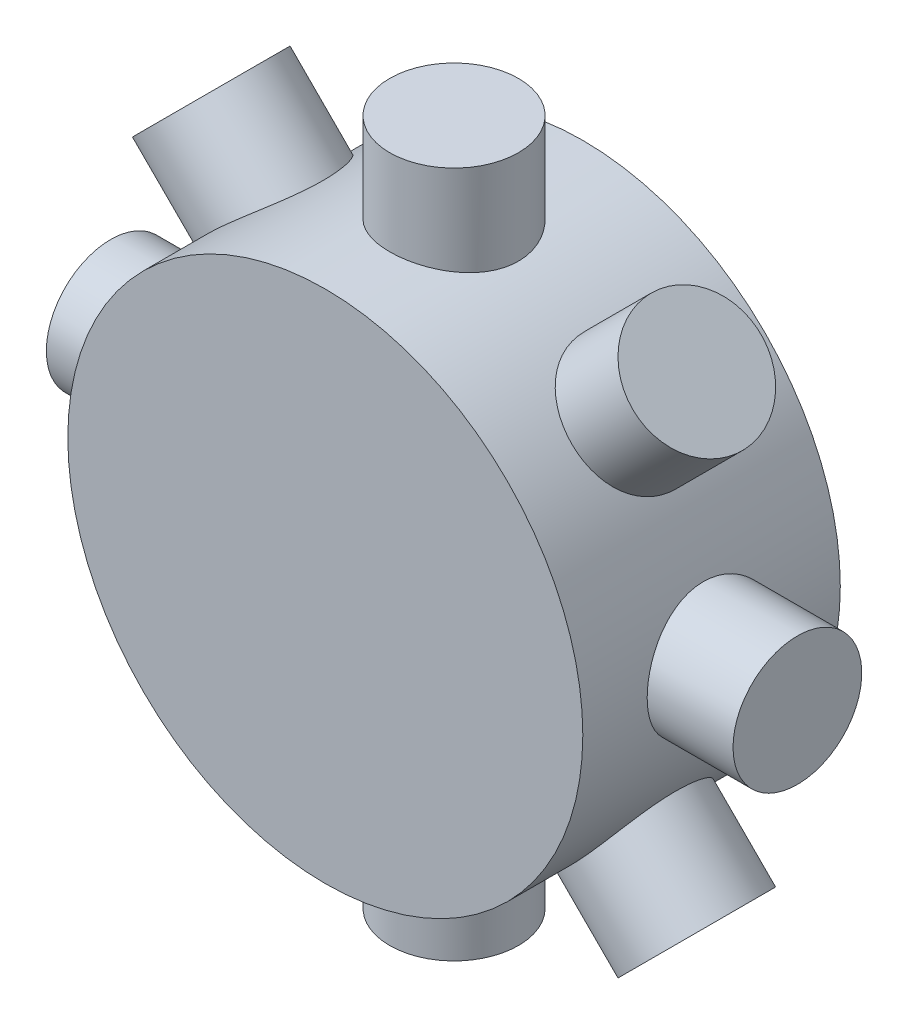
from build123d import *

# Parameters (mm, degrees)
SKIZZE1_R                       = 30
AUFSATZ_LINEAR_AUSTRAGEN1_DEPTH = 30
SKIZZE2_R                       = 7.5
AUFSATZ_LINEAR_AUSTRAGEN2_DEPTH = 40
KREISMUSTER1_COUNT              = 8


with BuildPart() as part:
    # Skizze1 → Aufsatz-Linear austragen1 (new body)
    with BuildSketch(Plane.XY):
        Circle(SKIZZE1_R)
    extrude(amount=AUFSATZ_LINEAR_AUSTRAGEN1_DEPTH)

    # Skizze2 → Aufsatz-Linear austragen2 (add)
    with BuildSketch(Plane(origin=(0, 0, 0), x_dir=(1, 0, 0), z_dir=(0, 1, 0))):
        with Locations(Location((0, -15, 0), (0, 0, 90))):
            Circle(SKIZZE2_R)
    aufsatz_linear_austragen2 = extrude(amount=AUFSATZ_LINEAR_AUSTRAGEN2_DEPTH)

    # Kreismuster1: Aufsatz-Linear austragen2 ×8 about axis
    kreismuster1_axis = Axis((0, 0, 0), (0, 0, 1))
    for i in range(1, KREISMUSTER1_COUNT):
        add(aufsatz_linear_austragen2.rotate(kreismuster1_axis, i * 360 / KREISMUSTER1_COUNT))


solid = part.part
